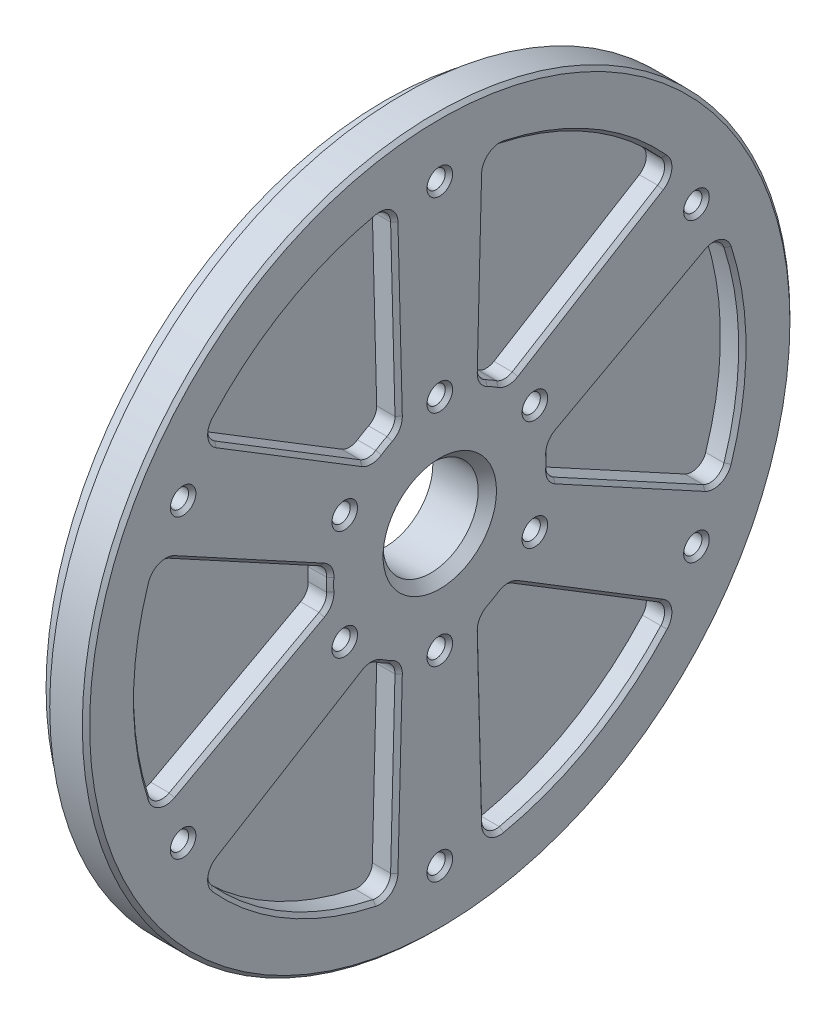
from build123d import *

# Parameters (mm, degrees)
SKETCH1_R           = 48.35
BOSS_EXTRUDE1_DEPTH = 2.725
SKETCH3_R           = 1.25
CUT_EXTRUDE1_DEPTH  = 3
CIRPATTERN1_COUNT   = 6
SKETCH4_R           = 1.25
CUT_EXTRUDE2_DEPTH  = 3
CIRPATTERN2_COUNT   = 6
SKETCH5_R           = 6.5
CUT_EXTRUDE3_DEPTH  = 5.45
CHAMFER1_SIZE       = 0.5
CHAMFER2_SIZE       = 1.25
CHAMFER3_SIZE       = 0.5
SKETCH6_R           = 46.35
SKETCH6_R_2         = 6.5
BOSS_EXTRUDE2_DEPTH = 2
CUT_EXTRUDE4_START  = -0.5
SKETCH7_R           = 48.35
SKETCH7_R_2         = 46.35
CUT_EXTRUDE4_DEPTH  = 0.5
CUT_EXTRUDE6_DEPTH  = 3
CIRPATTERN3_COUNT   = 6
CHAMFER4_SIZE       = 0.5


with BuildPart() as part:
    # Sketch1 → Boss-Extrude1 (new, symmetric)
    with BuildSketch(Plane(origin=(0, 0, 0), x_dir=(0, 0, -1), z_dir=(1, 0, 0))):
        Circle(SKETCH1_R)
    extrude(amount=BOSS_EXTRUDE1_DEPTH, both=True)

    # Sketch3 → Cut-Extrude1 (cut)
    with BuildSketch(Plane(origin=(2.725, 0, 0), x_dir=(0, 0, -1), z_dir=(1, 0, 0))):
        with Locations((0, 40.5)):
            Circle(SKETCH3_R)
    cut_extrude1 = extrude(amount=-CUT_EXTRUDE1_DEPTH, mode=Mode.SUBTRACT)

    # CirPattern1: Cut-Extrude1 ×6 about axis
    cirpattern1_axis = Axis((0, 0, 0), (1, 0, 0))
    for i in range(1, CIRPATTERN1_COUNT):
        add(cut_extrude1.rotate(cirpattern1_axis, i * 360 / CIRPATTERN1_COUNT), mode=Mode.SUBTRACT)

    # Sketch4 → Cut-Extrude2 (cut)
    with BuildSketch(Plane(origin=(2.725, 0, 0), x_dir=(0, 0, -1), z_dir=(1, 0, 0))):
        with Locations((0, 15)):
            Circle(SKETCH4_R)
    cut_extrude2 = extrude(amount=-CUT_EXTRUDE2_DEPTH, mode=Mode.SUBTRACT)

    # CirPattern2: Cut-Extrude2 ×6 about axis
    cirpattern2_axis = Axis((0, 0, 0), (1, 0, 0))
    for i in range(1, CIRPATTERN2_COUNT):
        add(cut_extrude2.rotate(cirpattern2_axis, i * 360 / CIRPATTERN2_COUNT), mode=Mode.SUBTRACT)

    # Sketch5 → Cut-Extrude3 (cut)
    with BuildSketch(Plane(origin=(2.725, 0, 0), x_dir=(0, 0, -1), z_dir=(1, 0, 0))):
        Circle(SKETCH5_R)
    extrude(amount=-CUT_EXTRUDE3_DEPTH, mode=Mode.SUBTRACT)

    # Chamfer1
    chamfer1_edges = [part.edges().sort_by_distance(p)[0] for p in [
        (2.725, 19.167468245, 35.699028853),
        (2.725, -21.332531755, 34.449028853),
        (2.725, -40.5, -1.25),
        (2.725, -19.167468245, -35.699028853),
        (2.725, 21.332531755, -34.449028853),
        (2.725, 15, 1.25),
        (2.725, 8.582531755, -12.365381057),
        (2.725, -6.417468245, -13.615381057),
        (2.725, -15, -1.25),
        (2.725, -8.582531755, 12.365381057),
        (2.725, 6.417468245, 13.615381057),
        (2.725, 40.5, 1.25),
    ]]
    chamfer(chamfer1_edges, length=CHAMFER1_SIZE)

    # Chamfer2
    chamfer2_edges = [part.edges().sort_by_distance(p)[0] for p in [
        (2.725, 0, 6.5),
    ]]
    chamfer(chamfer2_edges, length=CHAMFER2_SIZE)

    # Chamfer3
    chamfer3_edges = [part.edges().sort_by_distance(p)[0] for p in [
        (2.725, 0, 48.35),
    ]]
    chamfer(chamfer3_edges, length=CHAMFER3_SIZE)

    # Sketch6 → Boss-Extrude2 (add)
    with BuildSketch(Plane.ZY.offset(2.725)):
        Circle(SKETCH6_R)
        with Locations(Location((0, 0, 0), (0, 0, 180))):
            Circle(SKETCH6_R_2, mode=Mode.SUBTRACT)
    extrude(amount=BOSS_EXTRUDE2_DEPTH)

    # Sketch7 → Cut-Extrude4 (cut)
    with BuildSketch(Plane.ZY.offset(2.725).offset(CUT_EXTRUDE4_START)):
        Circle(SKETCH7_R)
        Circle(SKETCH7_R_2, mode=Mode.SUBTRACT)
    extrude(amount=CUT_EXTRUDE4_DEPTH, mode=Mode.SUBTRACT)

    # Sketch9 → Cut-Extrude6 (cut)
    with BuildSketch(Plane(origin=(2.725, 0, 0), x_dir=(0, 0, -1), z_dir=(1, 0, 0))):
        with BuildLine():
            Line((-6.216449103, 38.533984802), (-5.619911931, 15.248157726))
            ThreePointArc((-5.619911931, 15.248157726), (-5.904066218, 14.168286857), (-6.722872915, 13.409063344))
            ThreePointArc((-6.722872915, 13.409063344), (-7.5, 12.990381057), (-8.251153039, 12.526710403))
            ThreePointArc((-8.251153039, 12.526710403), (-9.318063238, 12.197214759), (-10.395335986, 12.491065362))
            Line((-10.395335986, 12.491065362), (-30.263185196, 24.650595245))
            ThreePointArc((-30.263185196, 24.650595245), (-31.198505813, 26.069807791), (-30.704246509, 27.696060123))
            ThreePointArc((-30.704246509, 27.696060123), (-20.675, 35.810150446), (-8.633368397, 40.438687542))
            ThreePointArc((-8.633368397, 40.438687542), (-6.977862912, 40.05360249), (-6.216449103, 38.533984802))
        make_face()
    cut_extrude6 = extrude(amount=-CUT_EXTRUDE6_DEPTH, mode=Mode.SUBTRACT)

    # CirPattern3: Cut-Extrude6 ×6 about axis
    cirpattern3_axis = Axis((0, 0, 0), (1, 0, 0))
    for i in range(1, CIRPATTERN3_COUNT):
        add(cut_extrude6.rotate(cirpattern3_axis, i * 360 / CIRPATTERN3_COUNT), mode=Mode.SUBTRACT)

    # Chamfer4
    chamfer4_edges = [part.edges().sort_by_distance(p)[0] for p in [
        (2.725, 40.05360249, 6.977862912),
        (2.725, 35.810150446, 20.675),
        (2.725, 26.069807791, 31.198505813),
        (2.725, 18.570830304, 20.329260591),
        (2.725, 12.197214759, 9.318063238),
        (2.725, 12.990381057, 7.5),
        (2.725, 14.168286857, 5.904066218),
        (2.725, 26.891071264, 5.918180517),
        (2.725, -26.069807791, 31.198505813),
        (2.725, -35.810150447, 20.675),
        (2.725, -40.05360249, 6.977862912),
        (2.725, -26.891071264, 5.918180517),
        (2.725, -14.168286857, 5.904066218),
        (2.725, -12.990381057, 7.5),
        (2.725, -12.197214759, 9.318063238),
        (2.725, -18.570830304, 20.329260591),
        (2.725, 13.983794699, 38.176368726),
        (2.725, 0, 41.35),
        (2.725, -13.983794699, 38.176368726),
        (2.725, -8.32024096, 26.247441108),
        (2.725, -1.971072098, 15.222129456),
        (2.725, 0, 15),
        (2.725, 1.971072098, 15.222129456),
        (2.725, 8.32024096, 26.247441108),
        (2.725, -13.983794699, -38.176368726),
        (2.725, 0, -41.35),
        (2.725, 13.983794699, -38.176368726),
        (2.725, 8.32024096, -26.247441108),
        (2.725, 1.971072098, -15.222129456),
        (2.725, 0, -15),
        (2.725, -1.971072098, -15.222129456),
        (2.725, -8.32024096, -26.247441108),
        (2.725, -40.05360249, -6.977862912),
        (2.725, -35.810150446, -20.675),
        (2.725, -26.069807791, -31.198505813),
        (2.725, -18.570830304, -20.329260591),
        (2.725, -12.197214759, -9.318063238),
        (2.725, -12.990381057, -7.5),
        (2.725, -14.168286857, -5.904066218),
        (2.725, -26.891071264, -5.918180517),
        (2.725, 26.069807791, -31.198505813),
        (2.725, 35.810150447, -20.675),
        (2.725, 40.05360249, -6.977862912),
        (2.725, 26.891071264, -5.918180517),
        (2.725, 14.168286857, -5.904066218),
        (2.725, 12.990381057, -7.5),
        (2.725, 12.197214759, -9.318063238),
        (2.725, 18.570830304, -20.329260591),
    ]]
    chamfer(chamfer4_edges, length=CHAMFER4_SIZE)


solid = part.part
